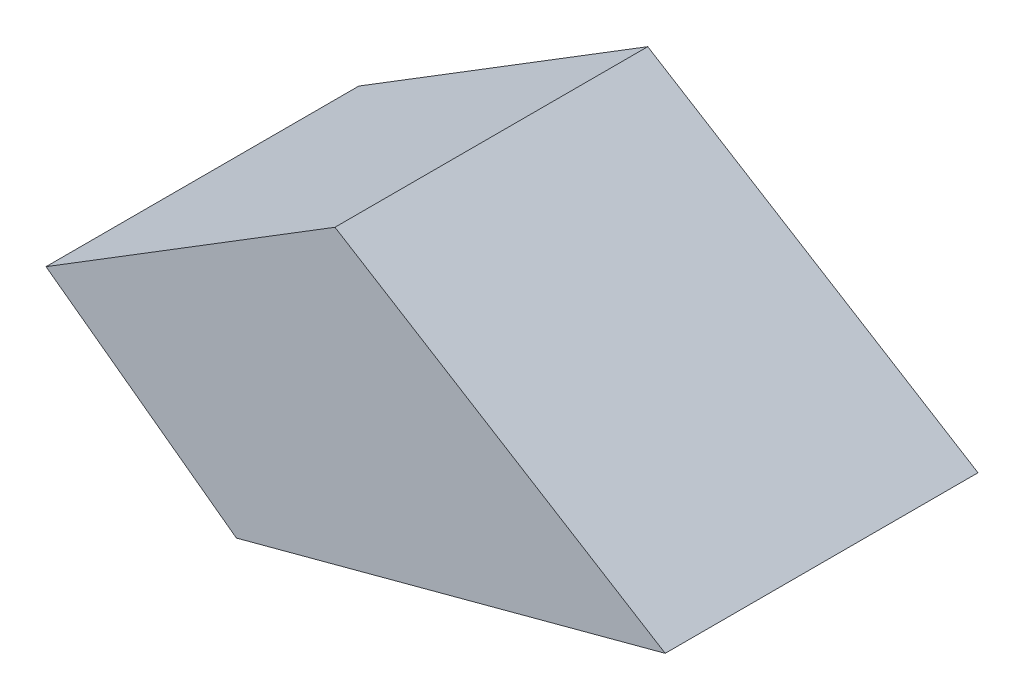
from build123d import *

# Parameters (mm, degrees)
BOSS_EXTRUDE1_DEPTH = 101.6


with BuildPart() as part:
    # Sketch1 → Boss-Extrude1 (new body)
    with BuildSketch(Plane.XY):
        Polygon((-77.990584573, 12.587954001), (15.871768089, 70.602002877), (123.143028274, 4.378418783), (-16.145419263, -32.838140873), align=None)
    extrude(amount=-BOSS_EXTRUDE1_DEPTH)


solid = part.part
